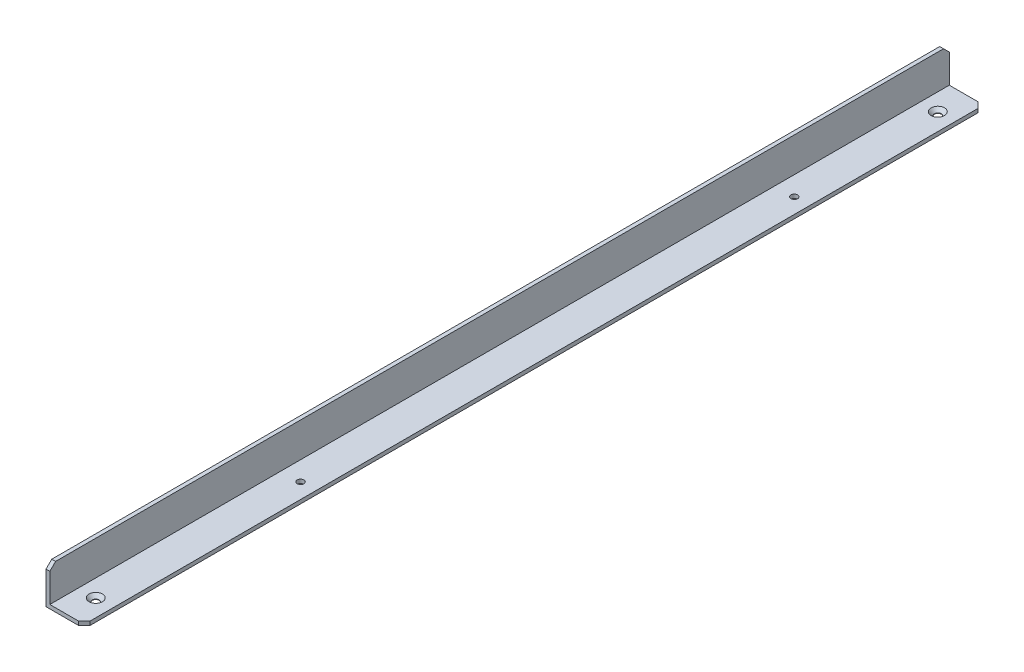
from build123d import *

# Parameters (mm, degrees)
BOSS_EXTRUDE1_DEPTH = 235
SKETCH3_R           = 1.75
CUT_EXTRUDE2_DEPTH  = 237.535409611
CHAMFER1_SIZE       = 3
SKETCH4_R           = 1.75
CUT_EXTRUDE3_DEPTH  = 237.535409611


with BuildPart() as part:
    # Sketch1 → Boss-Extrude1 (new, symmetric)
    with BuildSketch(Plane.XY):
        Polygon((0, 0), (20, 0), (20, 2), (2, 2), (2, 20), (0, 20), align=None)
    extrude(amount=BOSS_EXTRUDE1_DEPTH, both=True)

    # Cut-Extrude1 cone 1 section (through the dimple's axis) → Cut-Extrude1 (revolve, cut)
    with BuildSketch(Plane(origin=(11, 2, -220), x_dir=(0, 0, 1), z_dir=(1, 0, 0))):
        Polygon((0, 0), (3.5, 0), (0, 3.5), align=None)
    revolve(axis=Axis((11, 2, -220), (0, -1, 0)), mode=Mode.SUBTRACT)

    # Cut-Extrude1 cone 2 section (through the dimple's axis) → Cut-Extrude1 cone 2 (revolve, cut)
    with BuildSketch(Plane(origin=(11, 2, 220), x_dir=(0, 0, 1), z_dir=(1, 0, 0))):
        Polygon((0, 0), (3.5, 0), (0, 3.5), align=None)
    revolve(axis=Axis((11, 2, 220), (0, -1, 0)), mode=Mode.SUBTRACT)

    # Sketch3 → Cut-Extrude2 (cut, through all)
    with BuildSketch(Plane(origin=(0, 2, 0), x_dir=(1, 0, 0), z_dir=(0, 1, 0))):
        with Locations(Location((11, -220, 0), (0, 0, 180))):
            Circle(SKETCH3_R)
        with Locations(Location((11, 220, 0), (0, 0, 180))):
            Circle(SKETCH3_R)
    extrude(amount=-CUT_EXTRUDE2_DEPTH, mode=Mode.SUBTRACT)

    # Chamfer1
    chamfer1_edges = [part.edges().sort_by_distance(p)[0] for p in [
        (20, 1, 235),
        (1, 20, 235),
        (1, 20, -235),
        (20, 1, -235),
    ]]
    chamfer(chamfer1_edges, length=CHAMFER1_SIZE)

    # Sketch4 → Cut-Extrude3 (cut, through all)
    with BuildSketch(Plane(origin=(0, 2, 0), x_dir=(1, 0, 0), z_dir=(0, 1, 0))):
        with Locations(Location((12, 144, 0), (0, 0, 180))):
            Circle(SKETCH4_R)
        with Locations(Location((12, -114, 0), (0, 0, 180))):
            Circle(SKETCH4_R)
    extrude(amount=-CUT_EXTRUDE3_DEPTH, mode=Mode.SUBTRACT)


solid = part.part
